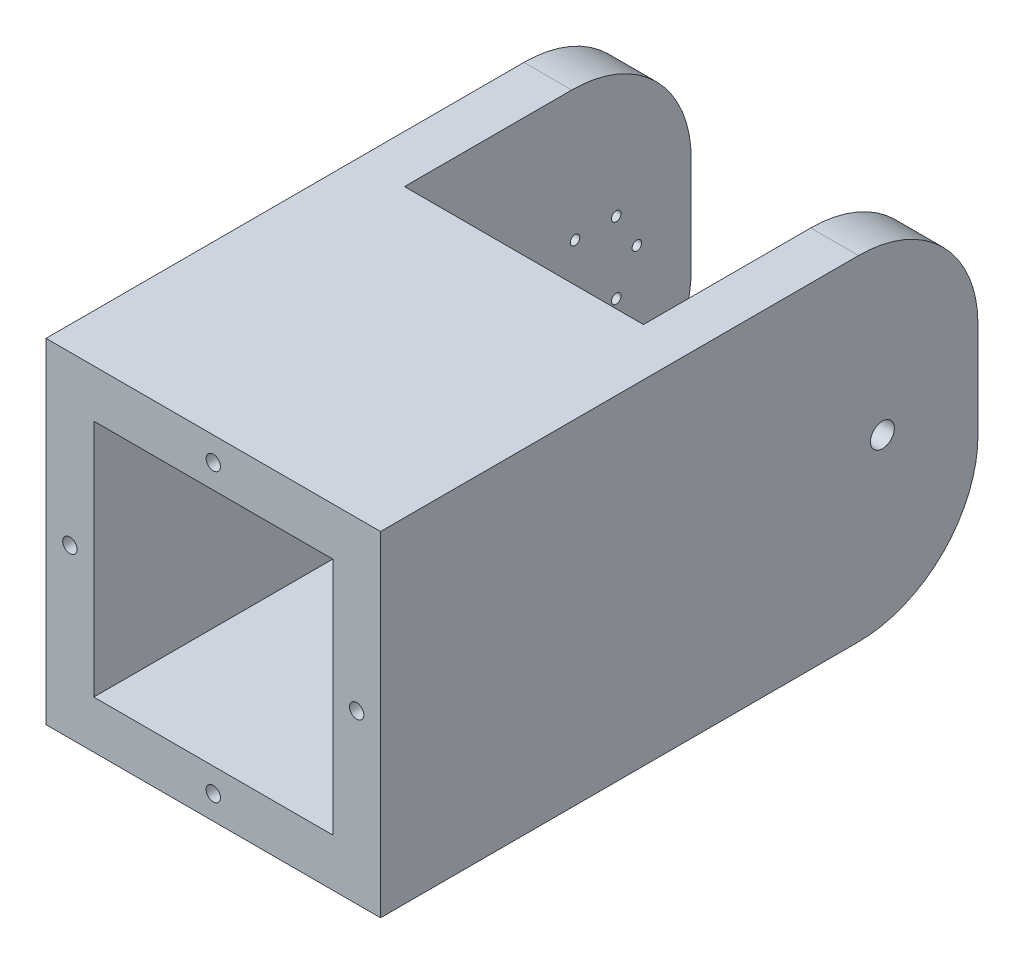
from build123d import *

# Parameters (mm, degrees)
SKETCH_1_W           = 140
SKETCH_1_H           = 140
SKETCH_1_W_2         = 100
SKETCH_1_H_2         = 100
EXTRUDE_3_DEPTH      = 250
SKETCH_2_W           = 100
SKETCH_2_H           = 140
CUT_EXTRUDE_1_DEPTH  = 120
SKETCH_4_R           = 15.704370783
SKETCH_4_R_2         = 3
CUT_EXTRUDE_2_DEPTH  = 10
SKETCH_8_R           = 2
CUT_EXTRUDE_3_DEPTH  = 20
FILLET_1_R           = 50
SKETCH_10_R          = 22.5
CUT_EXTRUDE_4_DEPTH  = 10
SKETCH_11_R          = 5
CUT_EXTRUDE_10_DEPTH = 12


with BuildPart() as part:
    # 草图1 → 凸台-拉伸3 (new body)
    with BuildSketch(Plane.XY):
        with Locations((-127.289473684, 36.657894737)):
            Rectangle(SKETCH_1_W, SKETCH_1_H)
        with Locations((-127.289473684, 36.657894737)):
            Rectangle(SKETCH_1_W_2, SKETCH_1_H_2, mode=Mode.SUBTRACT)
    extrude(amount=EXTRUDE_3_DEPTH)

    # 草图2 → 切除-拉伸1 (cut)
    with BuildSketch(Plane(origin=(0, 0, 0), x_dir=(-1, 0, 0), z_dir=(0, 0, -1))):
        with Locations((127.289473684, 36.657894737)):
            Rectangle(SKETCH_2_W, SKETCH_2_H)
    extrude(amount=-CUT_EXTRUDE_1_DEPTH, mode=Mode.SUBTRACT)

    # 草图4 → 切除-拉伸2 (cut)
    with BuildSketch(Plane.XY.offset(250)):
        with Locations((-127.289473684, 36.657894737)):
            Circle(SKETCH_4_R)
        with Locations((-187.289473684, 36.657894737)):
            Circle(SKETCH_4_R_2)
        with Locations((-127.289473684, 96.657894737)):
            Circle(SKETCH_4_R_2)
        with Locations((-67.289473684, 36.657894737)):
            Circle(SKETCH_4_R_2)
        with Locations((-127.289473684, -23.342105263)):
            Circle(SKETCH_4_R_2)
    extrude(amount=-CUT_EXTRUDE_2_DEPTH, mode=Mode.SUBTRACT)

    # 草图8 → 切除-拉伸3 (cut)
    with BuildSketch(Plane.ZY.offset(197.289473684)):
        with Locations((22.75, 36.657894737)):
            Circle(SKETCH_8_R)
        with Locations((31.375, 51.596832952)):
            Circle(SKETCH_8_R)
        with Locations((48.625, 51.596832952)):
            Circle(SKETCH_8_R)
        with Locations((57.25, 36.657894737)):
            Circle(SKETCH_8_R)
        with Locations((48.625, 21.718956522)):
            Circle(SKETCH_8_R)
        with Locations((31.375, 21.718956522)):
            Circle(SKETCH_8_R)
    extrude(amount=-CUT_EXTRUDE_3_DEPTH, mode=Mode.SUBTRACT)

    # 圆角1
    fillet_1_edges = [part.edges().sort_by_distance(p)[0] for p in [
        (-67.289473684, -33.342105263, 0),
        (-187.289473684, 106.657894737, 0),
        (-187.289473684, -33.342105263, 0),
        (-67.289473684, 106.657894737, 0),
    ]]
    fillet(fillet_1_edges, radius=FILLET_1_R)

    # 草图10 → 切除-拉伸4 (cut)
    with BuildSketch(Plane.ZY.offset(77.289473684)):
        with Locations((40, 36.657894737)):
            Circle(SKETCH_10_R)
    extrude(amount=-CUT_EXTRUDE_4_DEPTH, mode=Mode.SUBTRACT)

    # 草图11 → 切除-拉伸10 (cut)
    with BuildSketch(Plane.ZY.offset(67.289473684)):
        with Locations((40, 36.657894737)):
            Circle(SKETCH_11_R)
    extrude(amount=-CUT_EXTRUDE_10_DEPTH, mode=Mode.SUBTRACT)


solid = part.part
